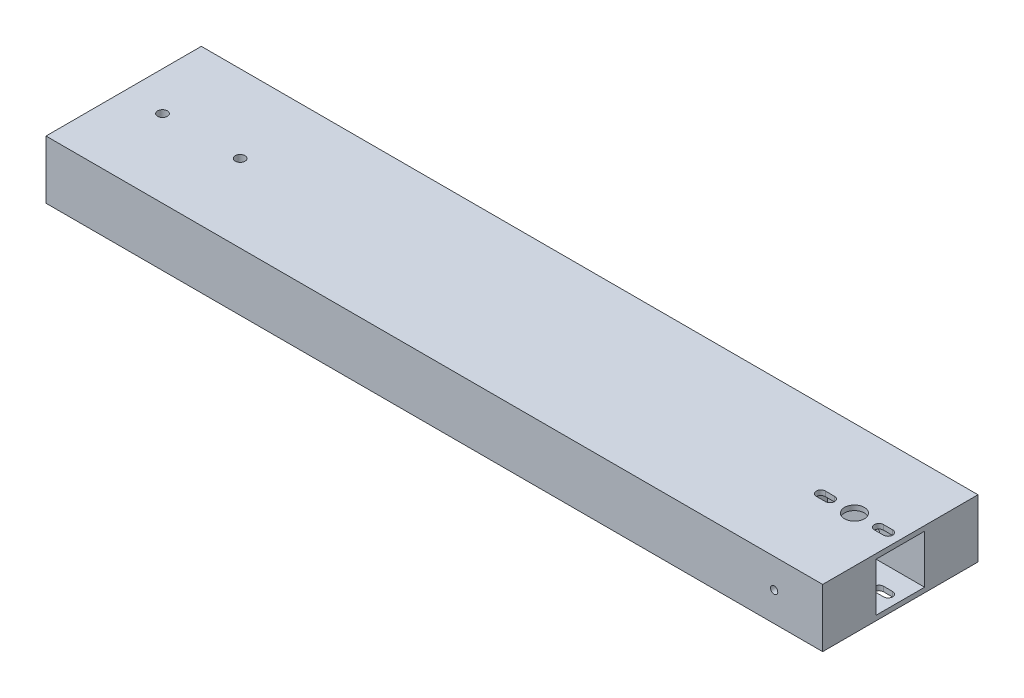
from build123d import *

# Parameters (mm, degrees)
SKETCH1_W           = 254
SKETCH1_H           = 50.8
BOSS_EXTRUDE1_DEPTH = 19.05
SKETCH2_R           = 1.5875
SKETCH2_R_2         = 3.24993
CUT_EXTRUDE1_DEPTH  = 131.908603613
SKETCH3_R           = 1.19126
CUT_EXTRUDE2_DEPTH  = 139.103376135
SKETCH4_W           = 15.875
SKETCH4_H           = 15.875
CUT_EXTRUDE3_DEPTH  = 31.75508


with BuildPart() as part:
    # Sketch1 → Boss-Extrude1 (new body)
    with BuildSketch(Plane(origin=(0, 0, 0), x_dir=(1, 0, 0), z_dir=(0, 1, 0))):
        Rectangle(SKETCH1_W, SKETCH1_H)
    extrude(amount=BOSS_EXTRUDE1_DEPTH)

    # Sketch2 → Cut-Extrude1 (cut, through all)
    with BuildSketch(Plane(origin=(0, 19.05, 0), x_dir=(1, 0, 0), z_dir=(0, 1, 0))):
        with Locations(Location((-114.3, 0, 0), (0, 0, 270))):
            Circle(SKETCH2_R)
        with Locations(Location((-88.9, 0, 0), (0, 0, 270))):
            Circle(SKETCH2_R)
        with Locations(Location((111.99876, 0, 0), (0, 0, 270))):
            Circle(SKETCH2_R_2)
        with BuildLine():
            Line((122.9995, -1.50114), (119.99976, -1.50114))
            ThreePointArc((119.99976, -1.50114), (118.49862, 0), (119.99976, 1.50114))
            Line((119.99976, 1.50114), (122.9995, 1.50114))
            ThreePointArc((122.9995, 1.50114), (124.50064, 0), (122.9995, -1.50114))
        make_face()
        with BuildLine():
            Line((104.0003, -1.50114), (101.00056, -1.50114))
            ThreePointArc((101.00056, -1.50114), (99.49942, 0), (101.00056, 1.50114))
            Line((101.00056, 1.50114), (104.0003, 1.50114))
            ThreePointArc((104.0003, 1.50114), (105.50144, 0), (104.0003, -1.50114))
        make_face()
    extrude(amount=-CUT_EXTRUDE1_DEPTH, mode=Mode.SUBTRACT)

    # Sketch3 → Cut-Extrude2 (cut, through all)
    with BuildSketch(Plane.XY.offset(25.4)):
        with Locations((111.125, 9.525)):
            Circle(SKETCH3_R)
    extrude(amount=-CUT_EXTRUDE2_DEPTH, mode=Mode.SUBTRACT)

    # Sketch4 → Cut-Extrude3 (cut)
    with BuildSketch(Plane(origin=(127, 0, 0), x_dir=(0, 0, -1), z_dir=(1, 0, 0))):
        with Locations((0, 9.525)):
            Rectangle(SKETCH4_W, SKETCH4_H)
    extrude(amount=-CUT_EXTRUDE3_DEPTH, mode=Mode.SUBTRACT)


solid = part.part
